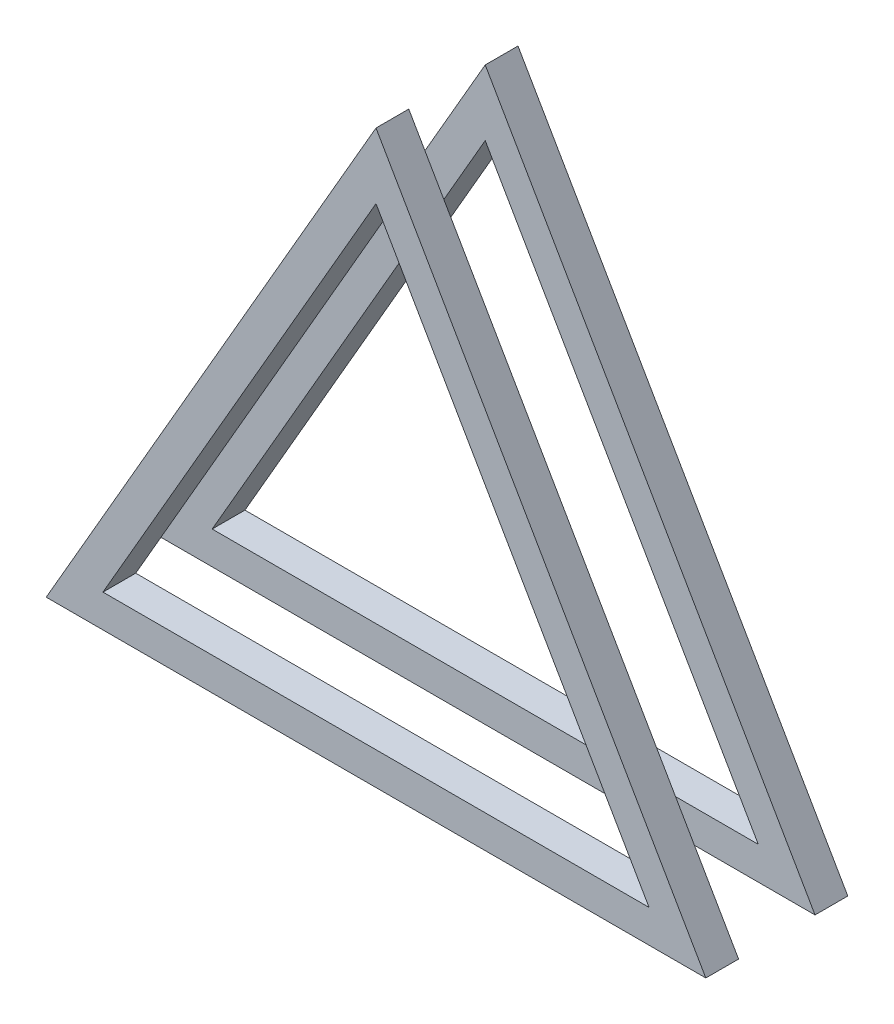
from build123d import *

# Parameters (mm, degrees)
BOSS_EXTRUDE2_DEPTH = 3
BOSS_EXTRUDE3_DEPTH = 3


with BuildPart() as part:
    # Sketch1 → Boss-Extrude2 (new body)
    with BuildSketch(Plane.XY):
        Polygon((55.196152423, -3), (25, 49.301270189), (-5.196152423, -3), align=None)
        Polygon((0, 0), (50, 0), (25, 43.301270189), align=None, mode=Mode.SUBTRACT)
    extrude(amount=BOSS_EXTRUDE2_DEPTH)


with BuildPart() as body_2:
    # Sketch2 → Boss-Extrude3 (new body)
    with BuildSketch(Plane.XY.offset(-10)):
        Polygon((55.196152423, -3), (25, 49.301270189), (-5.196152423, -3), align=None)
        Polygon((0, 0), (50, 0), (25, 43.301270189), align=None, mode=Mode.SUBTRACT)
    extrude(amount=BOSS_EXTRUDE3_DEPTH)


solid = Compound([part.part, body_2.part])
